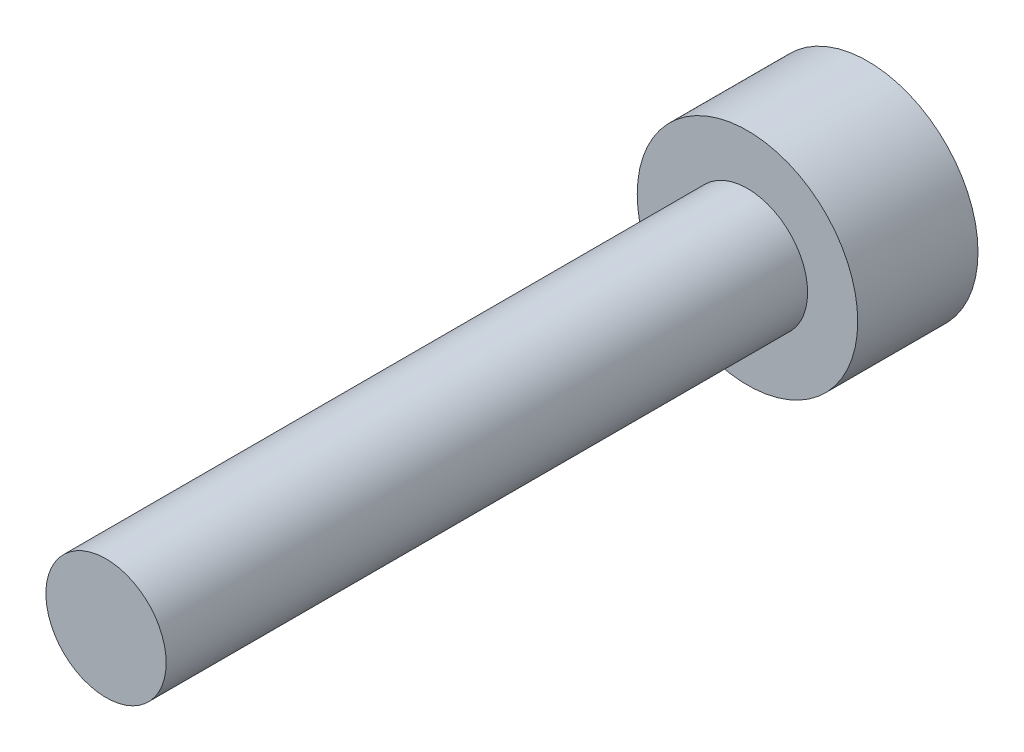
from build123d import *

# Parameters (mm, degrees)
HEAD_ENVELOPE_START         = -3
SKETCH1_R                   = 2.75
HEAD_ENVELOPE_DEPTH         = 3
SKETCH2_R                   = 1.5
THREAD_MAJOR_ENVELOPE_DEPTH = 16


with BuildPart() as part:
    # Sketch1 → Head_Envelope (new body)
    with BuildSketch(Plane.XY.offset(HEAD_ENVELOPE_START)):
        Circle(SKETCH1_R)
    extrude(amount=HEAD_ENVELOPE_DEPTH)

    # Sketch2 → Thread_Major_Envelope (add)
    with BuildSketch(Plane.XY):
        Circle(SKETCH2_R)
    extrude(amount=THREAD_MAJOR_ENVELOPE_DEPTH)


solid = part.part
